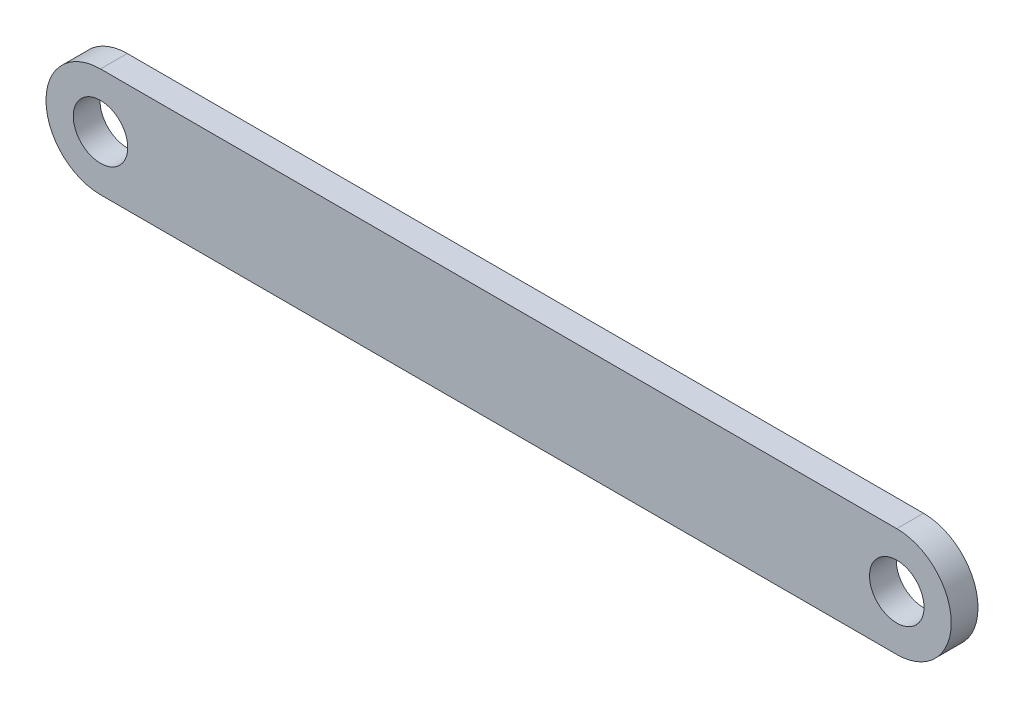
from build123d import *

# Parameters (mm, degrees)
SKETCH1_R      = 1.01901554
EXTRUDE1_DEPTH = 1


with BuildPart() as part:
    # Sketch1 → Extrude1 (new body)
    with BuildSketch(Plane.XY):
        with BuildLine():
            Line((0, 2.038031079), (-29.77622, 2.038031079))
            ThreePointArc((-29.77622, 2.038031079), (-31.814251079, 0), (-29.77622, -2.038031079))
            Line((-29.77622, -2.038031079), (0, -2.038031079))
            ThreePointArc((0, -2.038031079), (2.038031079, 0), (0, 2.038031079))
        make_face()
        with Locations((-29.77622, 0)):
            Circle(SKETCH1_R, mode=Mode.SUBTRACT)
        Circle(SKETCH1_R, mode=Mode.SUBTRACT)
    extrude(amount=EXTRUDE1_DEPTH)


solid = part.part
